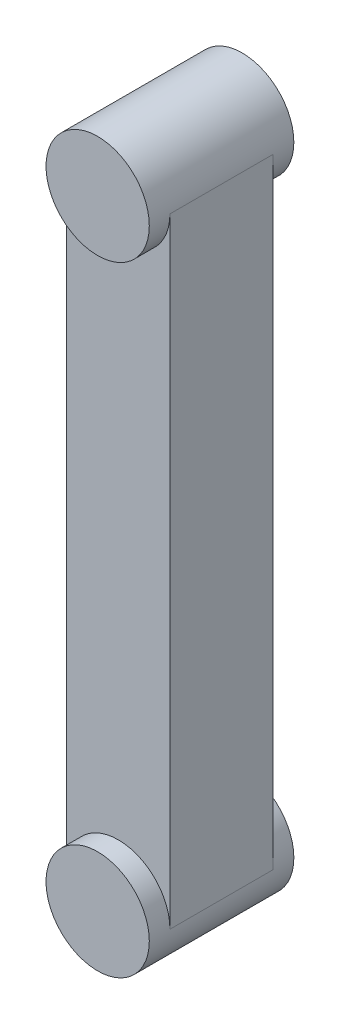
from build123d import *

# Parameters (mm, degrees)
EXTRUDE_1_DEPTH      = 35
EXTRUDE_1_DEPTH_BACK = 35
SKETCH_1_R           = 25
SKETCH_2_W           = 50
SKETCH_2_H           = 50
EXTRUDE_2_DEPTH      = 300
EXTRUDE_3_DEPTH      = 35
EXTRUDE_3_DEPTH_BACK = 35
SKETCH_3_R           = 25


with BuildPart() as part:
    # 草图1 → 凸台-拉伸1 (new, two sides: drawn at the far end of the back side and taken through both)
    with BuildSketch(Plane.XY.offset(-EXTRUDE_1_DEPTH_BACK)):
        Circle(SKETCH_1_R)
    extrude(amount=EXTRUDE_1_DEPTH + EXTRUDE_1_DEPTH_BACK)

    # 草图2 → 凸台-拉伸2 (add)
    with BuildSketch(Plane(origin=(0, 0, 0), x_dir=(1, 0, 0), z_dir=(0, 1, 0))):
        Rectangle(SKETCH_2_W, SKETCH_2_H)
    extrude(amount=EXTRUDE_2_DEPTH)

    # 草图3 → 凸台-拉伸3 (add, two sides: drawn at the far end of the back side and taken through both)
    with BuildSketch(Plane.XY.offset(-EXTRUDE_3_DEPTH_BACK)):
        with Locations((0, 300)):
            Circle(SKETCH_3_R)
    extrude(amount=EXTRUDE_3_DEPTH + EXTRUDE_3_DEPTH_BACK)


solid = part.part
